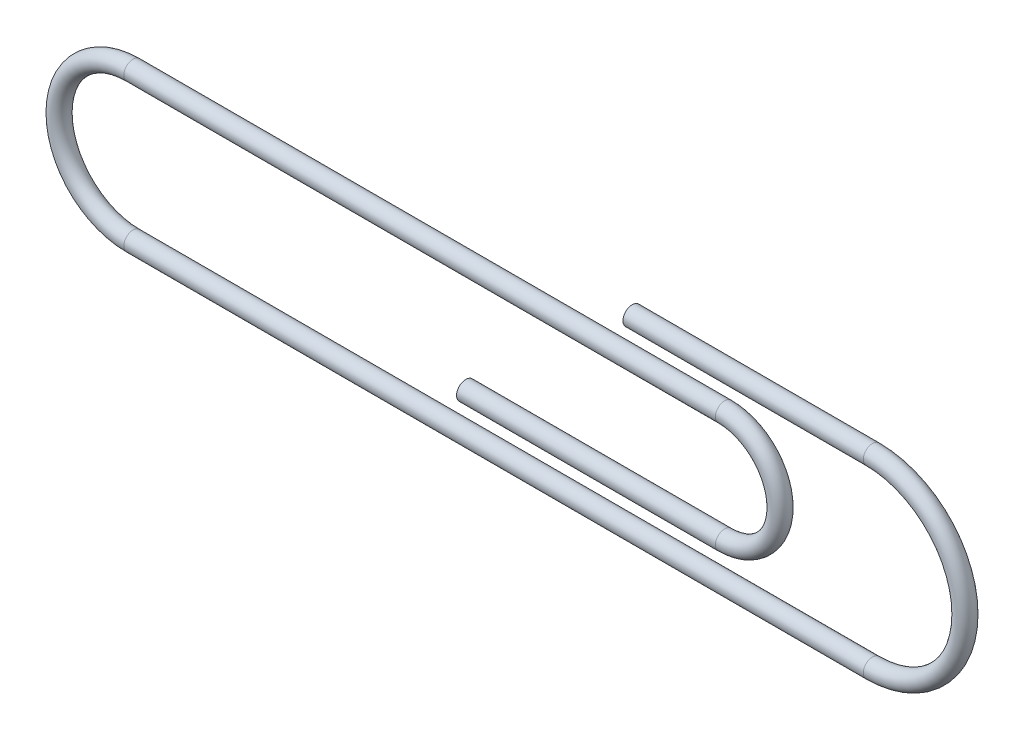
from build123d import *

# Parameters (mm, degrees)
SKETCH2_R = 2.5


with BuildPart() as part:
    # Sweep1: sweep along a path in Sketch1
    with BuildLine(Plane.XY) as sweep1_path:
        Line((0, 0), (70, 0))
        ThreePointArc((70, 0), (85, 15), (70, 30))
        Line((70, 30), (-90, 30))
        ThreePointArc((-90, 30), (-110, 10), (-90, -10))
        Line((-90, -10), (110, -10))
        ThreePointArc((110, -10), (135, 15), (110, 40))
        Line((110, 40), (45, 40))
    # Sketch2 → Sweep1 (sweep)
    with BuildSketch(Plane(origin=(0, 0, 0), x_dir=(0, 0, -1), z_dir=(1, 0, 0))):
        Circle(SKETCH2_R)
    sweep(path=sweep1_path.line)


solid = part.part
